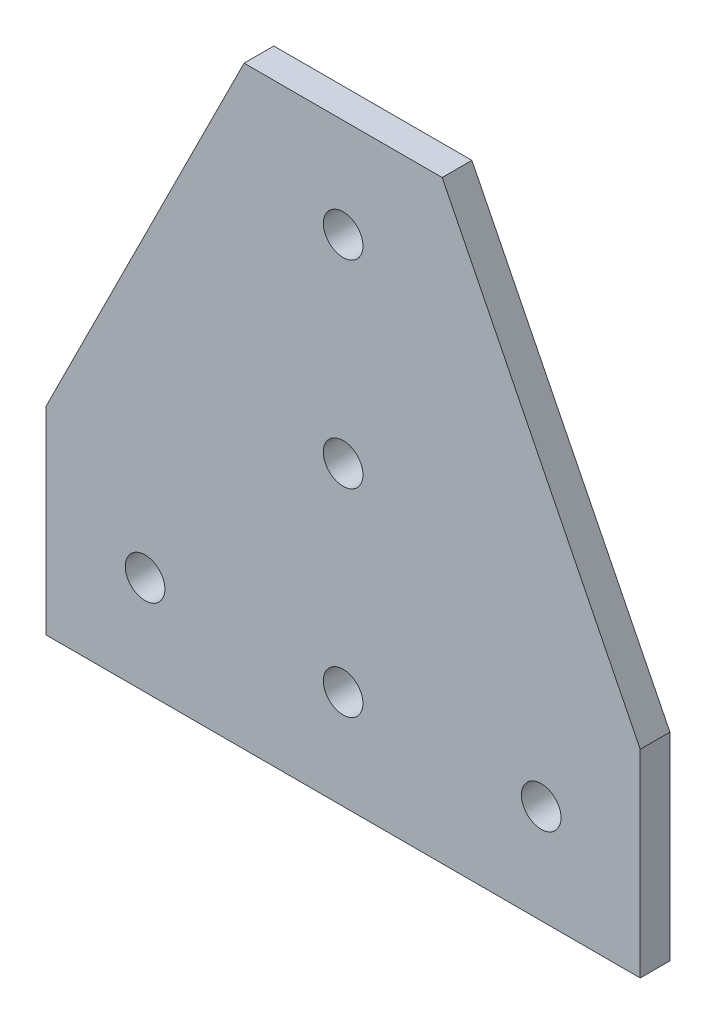
from build123d import *

# Parameters (mm, degrees)
SKETCH_1_R      = 2
EXTRUDE_1_DEPTH = 3


with BuildPart() as part:
    # 草图1 → 凸台-拉伸1 (new body)
    with BuildSketch(Plane.XY):
        Polygon((-64.3557518, -40.741880752), (-4.3557518, -40.741880752), (-4.3557518, -20.741880752), (-24.3557518, 19.258119248), (-44.3557518, 19.258119248), (-64.3557518, -20.741880752), align=None)
        with Locations((-54.3557518, -30.741880752)):
            Circle(SKETCH_1_R, mode=Mode.SUBTRACT)
        with Locations((-34.3557518, -30.741880752)):
            Circle(SKETCH_1_R, mode=Mode.SUBTRACT)
        with Locations((-14.3557518, -30.741880752)):
            Circle(SKETCH_1_R, mode=Mode.SUBTRACT)
        with Locations((-34.3557518, -10.741880752)):
            Circle(SKETCH_1_R, mode=Mode.SUBTRACT)
        with Locations((-34.3557518, 9.258119248)):
            Circle(SKETCH_1_R, mode=Mode.SUBTRACT)
    extrude(amount=EXTRUDE_1_DEPTH)


solid = part.part
